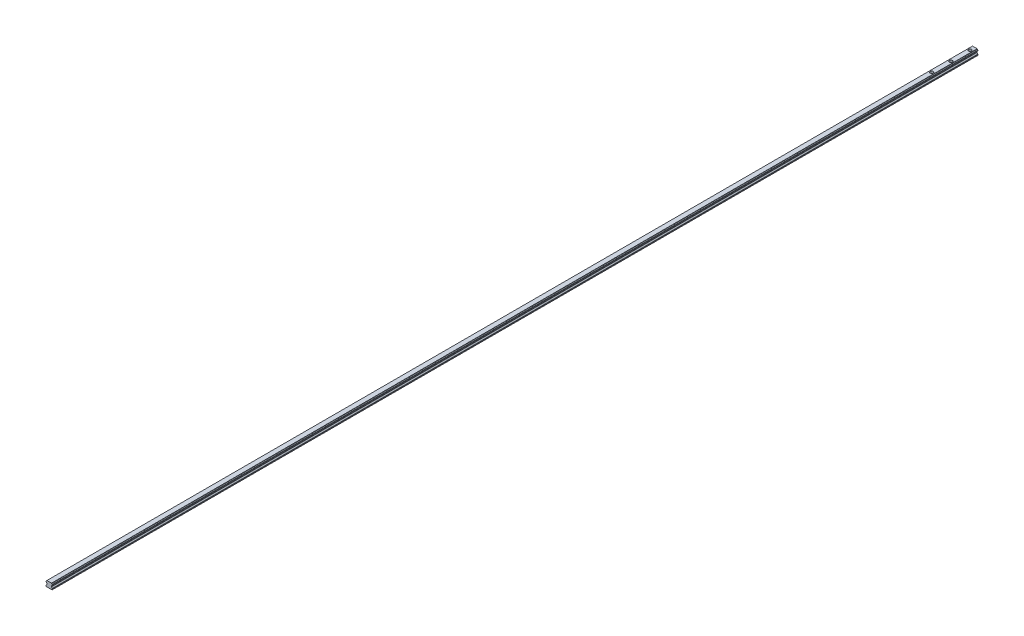
from build123d import *

# Parameters (mm, degrees)
ESTRUSIONE_ESTRUSIONE1_DEPTH = 2900
TAGLIO_ESTRUSIONE1_DEPTH     = 2901.070042258
TAGLIO_ESTRUSIONE2_REACH     = 2902.07
TAGLIO_ESTRUSIONE3_DEPTH     = 2901.070042258
TAGLIO_ESTRUSIONE4_DEPTH     = 2901.070042258
TAGLIO_ESTRUSIONE5_REACH     = 2902.07
TAGLIO_ESTRUSIONE6_DEPTH     = 2901.070042258
SFORMO1_ANGLE                = 44.999999999
SFORMO2_ANGLE                = 44.999999999
FORO1_D                      = 6
FORO1_CBORE_D                = 9.5
FORO1_CBORE_DEPTH            = 8.5
SMUSSO1_SIZE                 = 1
RACCORDO1_R                  = 0.5
RACCORDO2_R                  = 1


with BuildPart() as part:
    # Schizzo1 → Estrusione-Estrusione1 (new body)
    with BuildSketch(Plane(origin=(0, 0, -75), x_dir=(-1, 0, 0), z_dir=(0, 0, -1))):
        Polygon((-7.230720611, 0), (-10, -2.769279389), (-10, -17.5), (10, -17.5), (10, -2.769279389), (7.230720611, 0), align=None)
    extrude(amount=-ESTRUSIONE_ESTRUSIONE1_DEPTH)

    # Schizzo2 → Taglio-Estrusione1 (cut, through all)
    with BuildSketch(Plane.XY.offset(2825)):
        Polygon((10, -4.240720611), (6.6, -7.640720611), (6.6, -13.429279389), (10, -13.429279389), align=None)
    extrude(amount=-TAGLIO_ESTRUSIONE1_DEPTH, mode=Mode.SUBTRACT)

    # Schizzo3 → Taglio-Estrusione2 (cut, up to next)
    with BuildSketch(Plane.XY.offset(2825), mode=Mode.PRIVATE) as taglio_estrusione2_sk1:
        with BuildLine():
            Line((7.762144254, -6.478576357), (9.558632757, -4.682087854))
            ThreePointArc((9.558632757, -4.682087854), (8.344607784, -5.264551384), (7.762144254, -6.478576357))
        make_face()
    taglio_estrusione2_tool1 = extrude(taglio_estrusione2_sk1.sketch, amount=-TAGLIO_ESTRUSIONE2_REACH, mode=Mode.PRIVATE) & part.part
    add(taglio_estrusione2_tool1.solids().sort_by_distance((8.532804, -5.452748, 2825))[0], mode=Mode.SUBTRACT)

    # Schizzo4 → Taglio-Estrusione3 (cut, through all)
    with BuildSketch(Plane.XY.offset(2825)):
        Polygon((-10, -13.429279389), (-6.6, -13.429279389), (-6.6, -7.640720611), (-10, -4.240720611), align=None)
    extrude(amount=-TAGLIO_ESTRUSIONE3_DEPTH, mode=Mode.SUBTRACT)

    # Schizzo5 → Taglio-Estrusione4 (cut, through all)
    with BuildSketch(Plane.XY.offset(2825)):
        with BuildLine():
            Line((-9.558632757, -4.682087854), (-7.762144254, -6.478576357))
            ThreePointArc((-7.762144254, -6.478576357), (-8.344607784, -5.264551384), (-9.558632757, -4.682087854))
        make_face()
    extrude(amount=-TAGLIO_ESTRUSIONE4_DEPTH, mode=Mode.SUBTRACT)

    # Schizzo6 → Taglio-Estrusione5 (cut, up to next)
    with BuildSketch(Plane.XY.offset(2825), mode=Mode.PRIVATE) as taglio_estrusione5_sk1:
        with BuildLine():
            Line((-7.763380653, -0.532660042), (-9.547640358, -2.316919747))
            ThreePointArc((-9.547640358, -2.316919747), (-8.344607784, -1.735692616), (-7.763380653, -0.532660042))
        make_face()
    taglio_estrusione5_tool1 = extrude(taglio_estrusione5_sk1.sketch, amount=-TAGLIO_ESTRUSIONE5_REACH, mode=Mode.PRIVATE) & part.part
    add(taglio_estrusione5_tool1.solids().sort_by_distance((-8.529918, -1.550383, 2825))[0], mode=Mode.SUBTRACT)

    # Schizzo7 → Taglio-Estrusione6 (cut, through all)
    with BuildSketch(Plane.XY.offset(2825)):
        with BuildLine():
            Line((9.547640358, -2.316919747), (7.763380653, -0.532660042))
            ThreePointArc((7.763380653, -0.532660042), (8.344607784, -1.735692616), (9.547640358, -2.316919747))
        make_face()
    extrude(amount=-TAGLIO_ESTRUSIONE6_DEPTH, mode=Mode.SUBTRACT)

    # Sformo1
    sformo1_faces = [part.faces().sort_by_distance(p)[0] for p in [
        (8.3, -13.429279389, 1375),
    ]]
    draft(sformo1_faces, Plane(origin=(10, -2.769279389, 2825), x_dir=(0, 0, 1), z_dir=(1, 0, 0)), SFORMO1_ANGLE)

    # Sformo2
    sformo2_faces = [part.faces().sort_by_distance(p)[0] for p in [
        (-8.3, -13.429279389, 1375),
    ]]
    draft(sformo2_faces, Plane(origin=(-10, -17.5, 2825), x_dir=(0, -1, 0), z_dir=(-1, 0, 0)), SFORMO2_ANGLE)

    # Foro1 (through all)
    with Locations(Plane(origin=(0, 0, 0), x_dir=(1, 0, 0), z_dir=(0, 1, 0))):
        with Locations((0, 60), (0, 0), (0, -60)):
            CounterBoreHole(FORO1_D / 2, FORO1_CBORE_D / 2, FORO1_CBORE_DEPTH)

    # Smusso1
    smusso1_edges = [part.edges().sort_by_distance(p)[0] for p in [
        (-10, -17.5, 1375),
        (10, -17.5, 1375),
    ]]
    chamfer(smusso1_edges, length=SMUSSO1_SIZE)

    # Raccordo1
    raccordo1_edges = [part.edges().sort_by_distance(p)[0] for p in [
        (-10, -2.769279389, 1375),
        (10, -2.769279389, 1375),
        (10, -4.240720611, 1375),
        (7.762144254, -6.478576357, 1375),
        (9.558632757, -4.682087854, 1375),
        (-10, -4.240720611, 1375),
        (-9.558632757, -4.682087854, 1375),
        (-7.762144254, -6.478576357, 1375),
        (-7.763380653, -0.532660042, 1375),
        (-9.547640358, -2.316919747, 1375),
        (9.547640358, -2.316919747, 1375),
        (7.763380653, -0.532660042, 1375),
    ]]
    fillet(raccordo1_edges, radius=RACCORDO1_R)

    # Raccordo2
    raccordo2_edges = [part.edges().sort_by_distance(p)[0] for p in [
        (10, -13.429279389, 1375),
        (6.6, -10.029279389, 1375),
        (6.6, -7.640720611, 1375),
        (-10, -13.429279389, 1375),
        (-6.6, -7.640720611, 1375),
        (-6.6, -10.029279389, 1375),
    ]]
    fillet(raccordo2_edges, radius=RACCORDO2_R)


solid = part.part
